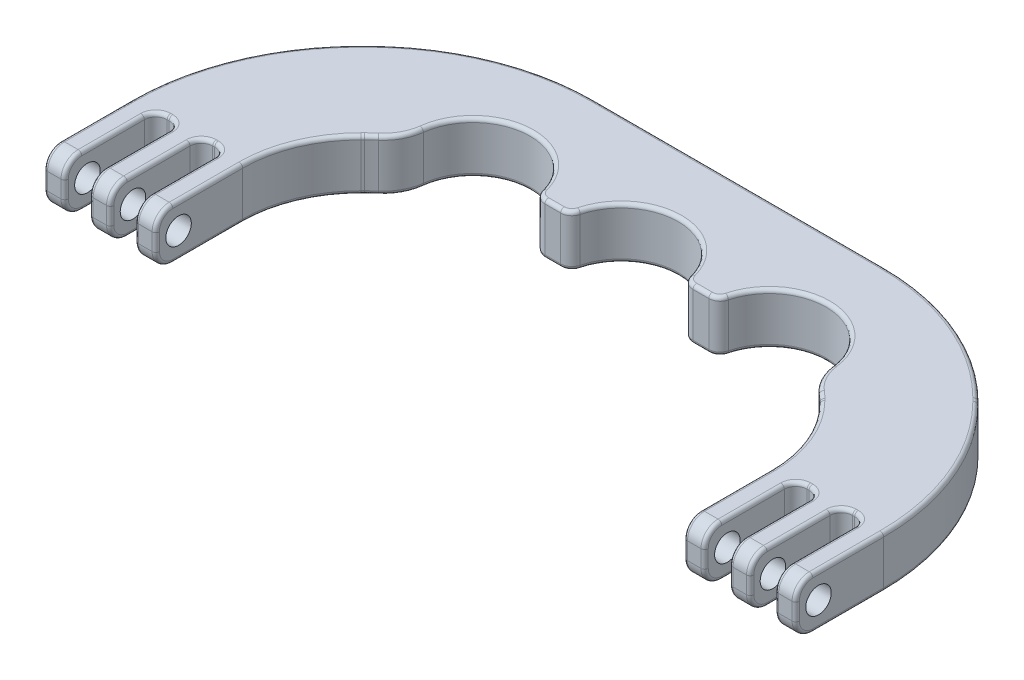
from build123d import *

# Parameters (mm, degrees)
PROFILE_DEPTH                = 7.14375
PROFILE_FILLET_I_R           = 31.75
PROFILE_FILLET_II_R          = 16.51
FASTENER_HOLES_DEPTH         = 115.03787217
FASTENER_HOLES_DEPTH_BACK    = 115.03787217
SKETCH2_R                    = 1.778
ATTACHMENT_FILLETS_R         = 2.38125
ATTACHMENT_FILLETS_II_R      = 1.5875
SKETCH3_R                    = 7.9375
GRIPPING_FEATURE_DEPTH       = 115.03787217
GRIPPING_FEATURE_FILLET_I_R  = 1.5875
GRIPPING_FEATURE_FILLET_II_R = 6.35
FILLET9_R                    = 0.508


with BuildPart() as part:
    # Sketch1 → Profile (new body)
    with BuildSketch(Plane(origin=(0, 0, 0), x_dir=(1, 0, 0), z_dir=(0, 1, 0))):
        Polygon((0, 0), (0, 12.7), (0, 25.4), (19.05, 44.45), (85.725, 44.45), (104.775, 25.4), (104.775, 12.7), (104.775, 0), (101.8794, 0), (101.8794, 12.7), (98.425, 12.7), (98.425, 0), (95.5294, 0), (95.5294, 12.7), (92.075, 12.7), (92.075, 0), (89.1794, 0), (89.1794, 12.7), (89.1794, 18.940090967), (79.265090967, 28.8544), (25.509909033, 28.8544), (15.5956, 18.940090967), (15.5956, 12.7), (15.5956, 0), (12.7, 0), (12.7, 12.7), (9.2456, 12.7), (9.2456, 0), (6.35, 0), (6.35, 12.7), (2.8956, 12.7), (2.8956, 0), align=None)
    extrude(amount=PROFILE_DEPTH)

    # Profile Fillet I
    profile_fillet_i_edges = [part.edges().sort_by_distance(p)[0] for p in [
        (0, 3.571875, -25.4),
        (19.05, 3.571875, -44.45),
        (85.725, 3.571875, -44.45),
        (104.775, 3.571875, -25.4),
    ]]
    fillet(profile_fillet_i_edges, radius=PROFILE_FILLET_I_R)

    # Profile Fillet II
    profile_fillet_ii_edges = [part.edges().sort_by_distance(p)[0] for p in [
        (89.1794, 3.571875, -18.940090967),
        (79.265090967, 3.571875, -28.8544),
        (25.509909033, 3.571875, -28.8544),
        (15.5956, 3.571875, -18.940090967),
    ]]
    fillet(profile_fillet_ii_edges, radius=PROFILE_FILLET_II_R)

    # Sketch2 → Fastener Holes (cut, two sides: drawn at the far end of the back side and taken through both)
    with BuildSketch(Plane.ZY.offset(-FASTENER_HOLES_DEPTH_BACK)):
        with Locations((-3.175, 3.571875)):
            Circle(SKETCH2_R)
    extrude(amount=FASTENER_HOLES_DEPTH + FASTENER_HOLES_DEPTH_BACK, mode=Mode.SUBTRACT)

    # Attachment Fillets
    attachment_fillets_edges = [part.edges().sort_by_distance(p)[0] for p in [
        (103.3272, 7.14375, 0),
        (7.7978, 7.14375, 0),
        (103.3272, 0, 0),
        (96.9772, 0, 0),
        (90.6272, 0, 0),
        (14.1478, 7.14375, 0),
        (14.1478, 0, 0),
        (7.7978, 0, 0),
        (1.4478, 0, 0),
        (1.4478, 7.14375, 0),
        (90.6272, 7.14375, 0),
        (96.9772, 7.14375, 0),
    ]]
    fillet(attachment_fillets_edges, radius=ATTACHMENT_FILLETS_R)

    # Attachment Fillets II
    attachment_fillets_ii_edges = [part.edges().sort_by_distance(p)[0] for p in [
        (101.8794, 3.571875, -12.7),
        (98.425, 3.571875, -12.7),
        (95.5294, 3.571875, -12.7),
        (92.075, 3.571875, -12.7),
        (12.7, 3.571875, -12.7),
        (9.2456, 3.571875, -12.7),
        (6.35, 3.571875, -12.7),
        (2.8956, 3.571875, -12.7),
    ]]
    fillet(attachment_fillets_ii_edges, radius=ATTACHMENT_FILLETS_II_R)

    # Sketch3 → Gripping Feature (cut, through all)
    with BuildSketch(Plane(origin=(0, 7.14375, 0), x_dir=(1, 0, 0), z_dir=(0, 1, 0))):
        with Locations((52.3875, 28.06065)):
            Circle(SKETCH3_R)
        with Locations((73.025, 28.06065)):
            Circle(SKETCH3_R)
        with Locations((31.75, 28.06065)):
            Circle(SKETCH3_R)
    extrude(amount=-GRIPPING_FEATURE_DEPTH, mode=Mode.SUBTRACT)

    # Gripping Feature Fillet I
    gripping_feature_fillet_i_edges = [part.edges().sort_by_distance(p)[0] for p in [
        (39.647712782, 3.571875, -28.8544),
        (65.127287218, 3.571875, -28.8544),
        (44.489787218, 3.571875, -28.8544),
        (60.285212782, 3.571875, -28.8544),
    ]]
    fillet(gripping_feature_fillet_i_edges, radius=GRIPPING_FEATURE_FILLET_I_R)

    # Gripping Feature Fillet II
    gripping_feature_fillet_ii_edges = [part.edges().sort_by_distance(p)[0] for p in [
        (23.955308273, 3.571875, -26.561754695),
        (80.819691727, 3.571875, -26.561754695),
    ]]
    fillet(gripping_feature_fillet_ii_edges, radius=GRIPPING_FEATURE_FILLET_II_R)

    # Fillet9
    fillet9_edges = [part.edges().sort_by_distance(p)[0] for p in [
        (89.1794, 0, -7.241337526),
        (89.1794, 7.14375, -7.241337526),
        (84.222245483, 0, -23.897245483),
        (84.222245483, 7.14375, -23.897245483),
        (20.552754517, 0, -23.897245483),
        (20.552754517, 7.14375, -23.897245483),
        (87.922651082, 0, -18.41952852),
        (87.922651082, 7.14375, -18.41952852),
        (83.610987796, 0, -24.488767264),
        (21.164012204, 7.14375, -24.488767264),
        (16.852348918, 0, -18.41952852),
        (16.852348918, 7.14375, -18.41952852),
        (104.775, 3.571875, 0),
        (101.8794, 3.571875, 0),
        (104.775, 0, -7.314984697),
        (104.775, 7.14375, -7.314984697),
        (104.775, 6.446298023, -0.697451977),
        (104.775, 0.697451977, -0.697451977),
        (98.425, 0, -6.746875),
        (92.075, 0, -6.746875),
        (15.5956, 0, -7.241337526),
        (9.2456, 0, -6.746875),
        (2.8956, 0, -6.746875),
        (101.8794, 6.446298023, -0.697451977),
        (101.8794, 0.697451977, -0.697451977),
        (2.8956, 7.14375, -6.746875),
        (9.2456, 7.14375, -6.746875),
        (15.5956, 7.14375, -7.241337526),
        (92.075, 7.14375, -6.746875),
        (98.425, 7.14375, -6.746875),
        (98.425, 3.571875, 0),
        (95.5294, 3.571875, 0),
        (98.425, 6.446298023, -0.697451977),
        (98.425, 0.697451977, -0.697451977),
        (95.5294, 6.446298023, -0.697451977),
        (95.5294, 0.697451977, -0.697451977),
        (92.075, 3.571875, 0),
        (89.1794, 3.571875, 0),
        (92.075, 6.446298023, -0.697451977),
        (92.075, 0.697451977, -0.697451977),
        (89.1794, 6.446298023, -0.697451977),
        (89.1794, 0.697451977, -0.697451977),
        (15.5956, 3.571875, 0),
        (15.5956, 0.697451977, -0.697451977),
        (15.5956, 6.446298023, -0.697451977),
        (12.7, 3.571875, 0),
        (12.7, 0.697451977, -0.697451977),
        (12.7, 6.446298023, -0.697451977),
        (9.2456, 3.571875, 0),
        (6.35, 3.571875, 0),
        (9.2456, 6.446298023, -0.697451977),
        (9.2456, 0.697451977, -0.697451977),
        (6.35, 6.446298023, -0.697451977),
        (6.35, 0.697451977, -0.697451977),
        (2.8956, 3.571875, 0),
        (0, 3.571875, 0),
        (2.8956, 6.446298023, -0.697451977),
        (2.8956, 0.697451977, -0.697451977),
        (0, 6.446298023, -0.697451977),
        (0, 0.697451977, -0.697451977),
        (101.8794, 0, -6.746875),
        (101.8794, 7.14375, -6.746875),
        (100.1522, 0, -12.7),
        (100.1522, 7.14375, -12.7),
        (95.5294, 0, -6.746875),
        (95.5294, 7.14375, -6.746875),
        (93.8022, 0, -12.7),
        (93.8022, 7.14375, -12.7),
        (12.7, 7.14375, -6.746875),
        (12.7, 0, -6.746875),
        (10.9728, 0, -12.7),
        (10.9728, 7.14375, -12.7),
        (6.35, 0, -6.746875),
        (6.35, 7.14375, -6.746875),
        (4.6228, 0, -12.7),
        (4.6228, 7.14375, -12.7),
        (101.414432015, 0, -12.235032015),
        (101.414432015, 7.14375, -12.235032015),
        (98.889967985, 0, -12.235032015),
        (98.889967985, 7.14375, -12.235032015),
        (95.064432015, 0, -12.235032015),
        (95.064432015, 7.14375, -12.235032015),
        (92.539967985, 0, -12.235032015),
        (92.539967985, 7.14375, -12.235032015),
        (12.235032015, 0, -12.235032015),
        (12.235032015, 7.14375, -12.235032015),
        (9.710567985, 0, -12.235032015),
        (9.710567985, 7.14375, -12.235032015),
        (5.885032015, 0, -12.235032015),
        (5.885032015, 7.14375, -12.235032015),
        (3.360567985, 0, -12.235032015),
        (3.360567985, 7.14375, -12.235032015),
        (62.70625, 0, -28.8544),
        (62.70625, 7.14375, -28.8544),
        (31.22689072, 7.14375, -35.980893868),
        (42.06875, 7.14375, -28.8544),
        (52.3875, 7.14375, -35.99815),
        (40.000400351, 7.14375, -29.186871054),
        (44.137099649, 7.14375, -29.186871054),
        (60.637900351, 7.14375, -29.186871054),
        (64.774599649, 7.14375, -29.186871054),
        (42.06875, 0, -28.8544),
        (31.22689072, 0, -35.980893868),
        (52.3875, 0, -35.99815),
        (40.000400351, 0, -29.186871054),
        (44.137099649, 0, -29.186871054),
        (60.637900351, 0, -29.186871054),
        (64.774599649, 0, -29.186871054),
        (83.610987796, 7.14375, -24.488767264),
        (73.54810928, 0, -35.980893868),
        (21.164012204, 0, -24.488767264),
        (23.156772691, 0, -26.77004908),
        (81.618227309, 0, -26.77004908),
        (73.54810928, 7.14375, -35.980893868),
        (23.156772691, 7.14375, -26.77004908),
        (81.618227309, 7.14375, -26.77004908),
        (95.25, 0, -34.925),
        (95.25, 7.14375, -34.925),
        (0, 0, -7.314984697),
        (9.525, 0, -34.925),
        (52.3875, 0, -44.45),
        (2.416824843, 0, -24.398918372),
        (20.051081628, 0, -42.033175157),
        (84.723918372, 0, -42.033175157),
        (102.358175157, 0, -24.398918372),
        (52.3875, 7.14375, -44.45),
        (9.525, 7.14375, -34.925),
        (0, 7.14375, -7.314984697),
        (2.416824843, 7.14375, -24.398918372),
        (20.051081628, 7.14375, -42.033175157),
        (84.723918372, 7.14375, -42.033175157),
        (102.358175157, 7.14375, -24.398918372),
    ]]
    fillet(fillet9_edges, radius=FILLET9_R)


solid = part.part
